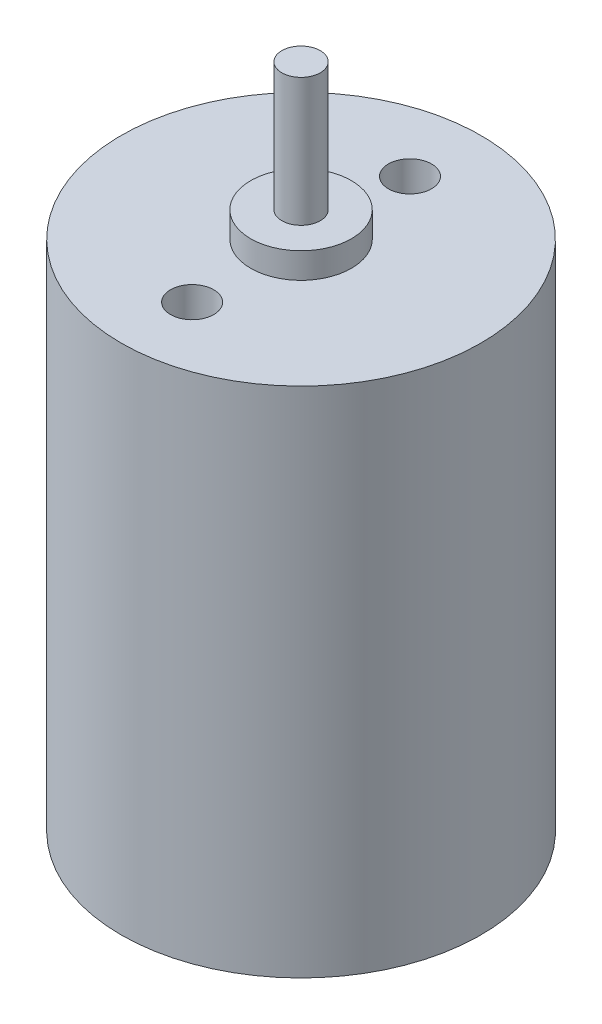
from build123d import *

# Parameters (mm, degrees)
SKETCH_2_R          = 14.036295278
EXTRUDE_1_DEPTH     = 40
SKETCH_2_4_R        = 3.930162678
EXTRUDE_2_DEPTH     = 2
SKETCH_2_5_R        = 1.5
EXTRUDE_3_DEPTH     = 12
SKETCH_2_6_R        = 1.684355433
CUT_EXTRUDE_1_DEPTH = 6


with BuildPart() as part:
    # 草圖2 → 填料-伸長1 (new body)
    with BuildSketch(Plane(origin=(0, 0, 0), x_dir=(1, 0, 0), z_dir=(0, 1, 0))):
        Circle(SKETCH_2_R)
    extrude(amount=-EXTRUDE_1_DEPTH)

    # 草圖2<4> → 填料-伸長2 (add)
    with BuildSketch(Plane(origin=(0, 0, 0), x_dir=(1, 0, 0), z_dir=(0, 1, 0))):
        Circle(SKETCH_2_4_R)
    extrude(amount=EXTRUDE_2_DEPTH)

    # 草圖2<5> → 填料-伸長3 (add)
    with BuildSketch(Plane(origin=(0, 0, 0), x_dir=(1, 0, 0), z_dir=(0, 1, 0))):
        Circle(SKETCH_2_5_R)
    extrude(amount=EXTRUDE_3_DEPTH)

    # 草圖2<6> → 除料-伸長1 (cut)
    with BuildSketch(Plane(origin=(0, 0, 0), x_dir=(1, 0, 0), z_dir=(0, 1, 0))):
        with Locations((0, 8.5)):
            Circle(SKETCH_2_6_R)
        with Locations((0, -8.5)):
            Circle(SKETCH_2_6_R)
    extrude(amount=-CUT_EXTRUDE_1_DEPTH, mode=Mode.SUBTRACT)


solid = part.part
